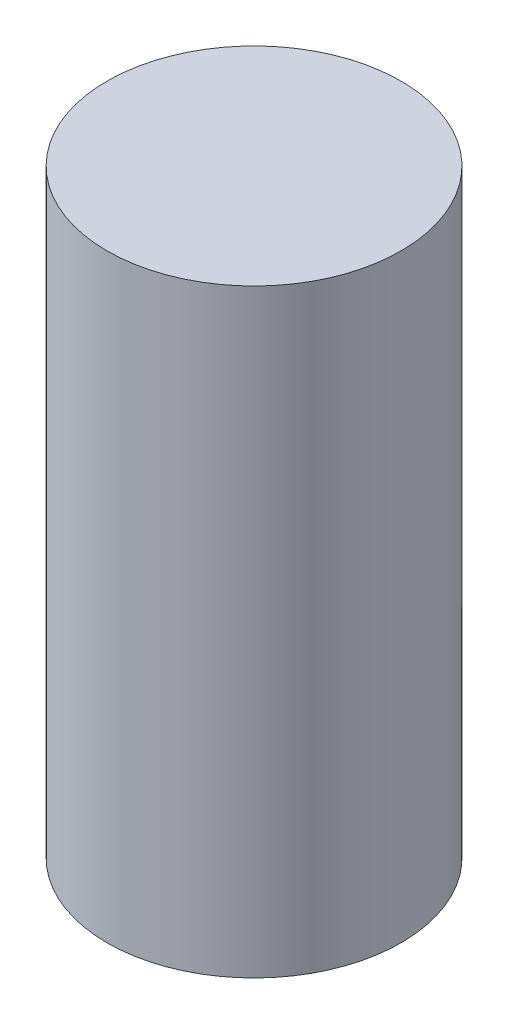
from build123d import *

# Parameters (mm, degrees)
ESQUISSE1_R        = 73.61
BOSS_EXTRU_1_DEPTH = 300


with BuildPart() as part:
    # Esquisse1 → Boss.-Extru.1 (new body)
    with BuildSketch(Plane(origin=(0, 0, 0), x_dir=(1, 0, 0), z_dir=(0, 1, 0))):
        with Locations(Location((0, 0, 0), (0, 0, 270))):
            Circle(ESQUISSE1_R)
    extrude(amount=BOSS_EXTRU_1_DEPTH)


solid = part.part
